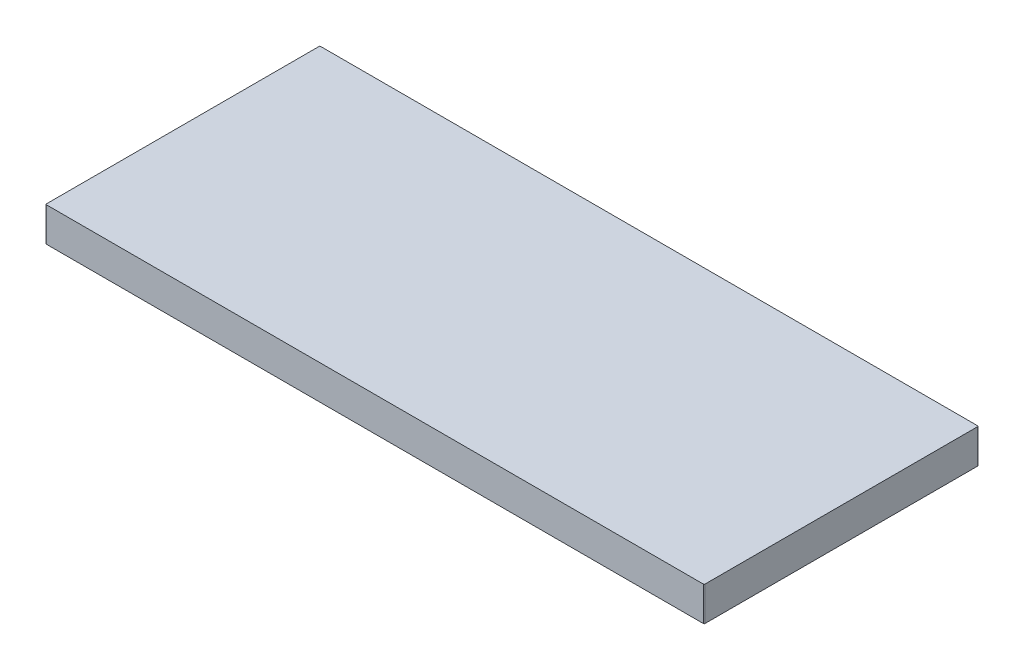
from build123d import *

# Parameters (mm, degrees)
SKETCH1_W           = 96.3
SKETCH1_H           = 40.1
BOSS_EXTRUDE1_DEPTH = 5
FILLET1_R           = 0.1


with BuildPart() as part:
    # Sketch1 → Boss-Extrude1 (new body)
    with BuildSketch(Plane(origin=(0, 0, 0), x_dir=(1, 0, 0), z_dir=(0, 1, 0))):
        Rectangle(SKETCH1_W, SKETCH1_H)
    extrude(amount=BOSS_EXTRUDE1_DEPTH)

    # Fillet1
    fillet1_edges = [part.edges().sort_by_distance(p)[0] for p in [
        (48.15, 2.5, 20.05),
        (-48.15, 2.5, 20.05),
        (-48.15, 2.5, -20.05),
        (48.15, 2.5, -20.05),
    ]]
    fillet(fillet1_edges, radius=FILLET1_R)


solid = part.part
